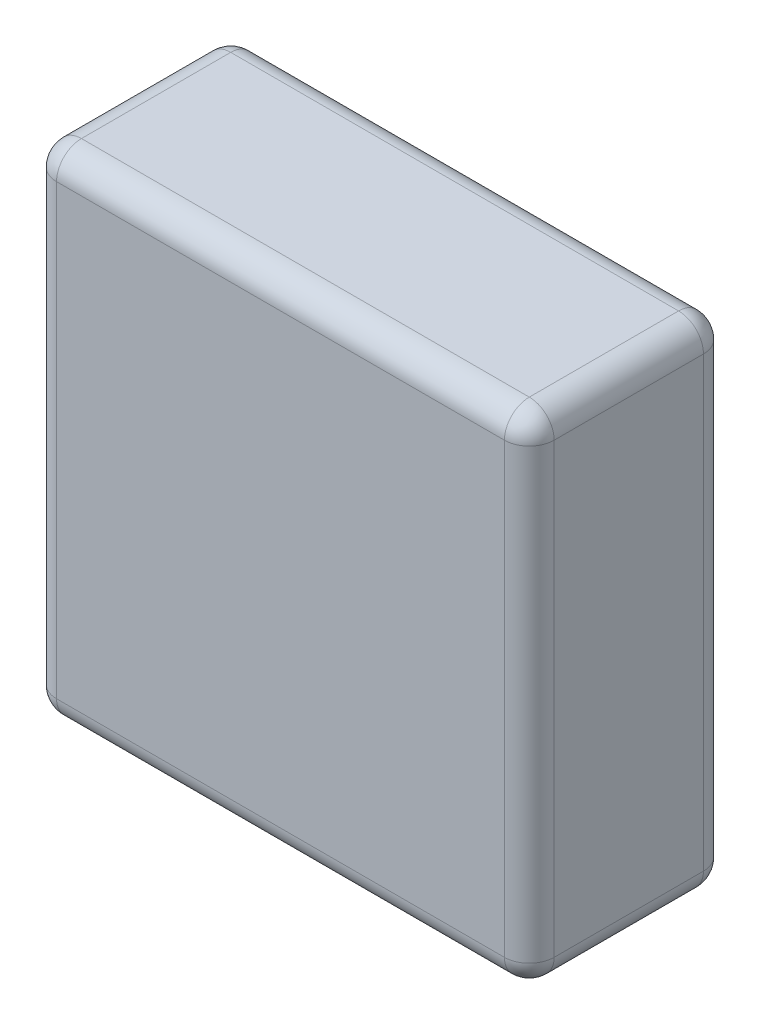
from build123d import *

# Parameters (mm, degrees)
ESQUISSE1_W        = 10
ESQUISSE1_H        = 10
BOSS_EXTRU_1_DEPTH = 4
CONG_1_R           = 0.5


with BuildPart() as part:
    # Esquisse1 → Boss.-Extru.1 (new body)
    with BuildSketch(Plane.XY):
        with Locations((5, -5)):
            Rectangle(ESQUISSE1_W, ESQUISSE1_H)
    extrude(amount=BOSS_EXTRU_1_DEPTH)

    # Congé1
    cong_1_edges = [part.edges().sort_by_distance(p)[0] for p in [
        (10, -5, 4),
        (5, 0, 4),
        (0, -5, 4),
        (5, 0, 0),
        (10, -5, 0),
        (5, -10, 0),
        (0, -5, 0),
        (5, -10, 4),
        (0, 0, 2),
        (10, 0, 2),
        (10, -10, 2),
        (0, -10, 2),
    ]]
    fillet(cong_1_edges, radius=CONG_1_R)


solid = part.part
